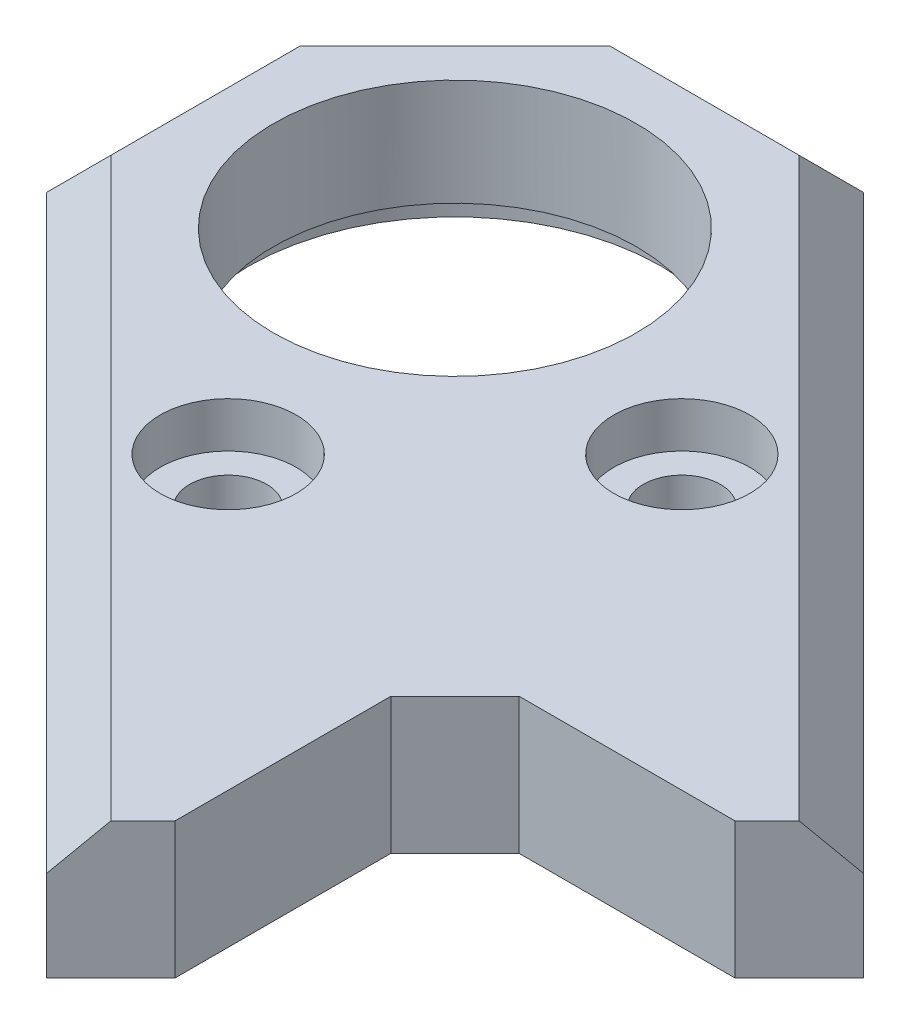
from build123d import *

# Parameters (mm, degrees)
SKETCH2_W           = 44
SKETCH2_H           = 44
BOSS_EXTRUDE1_DEPTH = 6
CHAMFER1_SIZE       = 18
SKETCH3_R           = 8
CUT_EXTRUDE1_DEPTH  = 32.685959036
SKETCH4_R           = 9.1
CUT_EXTRUDE2_DEPTH  = 1.3
CUT_EXTRUDE3_DEPTH  = 32.685959036
SKETCH7_R           = 1.7
CUT_EXTRUDE4_DEPTH  = 32.685959036
SKETCH8_R           = 3
CUT_EXTRUDE5_DEPTH  = 2
CHAMFER2_SIZE       = 2


with BuildPart() as part:
    # Sketch2 → Boss-Extrude1 (new body)
    with BuildSketch(Plane(origin=(0, 0, 0), x_dir=(1, 0, 0), z_dir=(0, 1, 0))):
        Rectangle(SKETCH2_W, SKETCH2_H)
    extrude(amount=BOSS_EXTRUDE1_DEPTH)

    # Chamfer1
    chamfer1_edges = [part.edges().sort_by_distance(p)[0] for p in [
        (22, 3, 22),
    ]]
    chamfer(chamfer1_edges, length=CHAMFER1_SIZE)

    # Sketch3 → Cut-Extrude1 (cut, through all)
    with BuildSketch(Plane(origin=(0, 6, 0), x_dir=(1, 0, 0), z_dir=(0, 1, 0))):
        with Locations(Location((-9.629833996, 9.625, 0), (0, 0, 270))):
            Circle(SKETCH3_R)
    extrude(amount=-CUT_EXTRUDE1_DEPTH, mode=Mode.SUBTRACT)

    # Sketch4 → Cut-Extrude2 (cut)
    with BuildSketch(Plane(origin=(0, 0, 0), x_dir=(-1, 0, 0), z_dir=(0, -1, 0))):
        with Locations(Location((9.629833996, 9.625, 0), (0, 0, 90))):
            Circle(SKETCH4_R)
    extrude(amount=-CUT_EXTRUDE2_DEPTH, mode=Mode.SUBTRACT)

    # Sketch5 → Cut-Extrude3 (cut, through all)
    with BuildSketch(Plane(origin=(0, 6, 0), x_dir=(1, 0, 0), z_dir=(0, 1, 0))):
        Polygon((-14, 22), (-22, 14), (-22, 22), align=None)
    extrude(amount=-CUT_EXTRUDE3_DEPTH, mode=Mode.SUBTRACT)

    # Sketch7 → Cut-Extrude4 (cut, through all)
    with BuildSketch(Plane(origin=(0, 6, 0), x_dir=(1, 0, 0), z_dir=(0, 1, 0))):
        with Locations(Location((4, 6, 0), (0, 0, 270))):
            Circle(SKETCH7_R)
        with Locations(Location((-6, -4, 0), (0, 0, 270))):
            Circle(SKETCH7_R)
        Polygon((-4, 22), (22, -4), (22, 22), align=None)
        Polygon((-22, 4), (4, -22), (-22, -22), align=None)
        Polygon((19.171572875, -6.828427125), (9.656854249, -6.828427125), (6.828427125, -9.656854249), (6.828427125, -19.171572875), align=None)
    extrude(amount=-CUT_EXTRUDE4_DEPTH, mode=Mode.SUBTRACT)

    # Sketch8 → Cut-Extrude5 (cut)
    with BuildSketch(Plane(origin=(0, 6, 0), x_dir=(1, 0, 0), z_dir=(0, 1, 0))):
        with Locations(Location((4, 6, 0), (0, 0, 270))):
            Circle(SKETCH8_R)
        with Locations(Location((-6, -4, 0), (0, 0, 270))):
            Circle(SKETCH8_R)
    extrude(amount=-CUT_EXTRUDE5_DEPTH, mode=Mode.SUBTRACT)

    # Chamfer2
    chamfer2_edges = [part.edges().sort_by_distance(p)[0] for p in [
        (-22, 6, -9),
        (-18, 6, -18),
        (-9, 6, -22),
        (-9, 6, 9),
        (9, 6, -9),
    ]]
    chamfer(chamfer2_edges, length=CHAMFER2_SIZE)


solid = part.part
